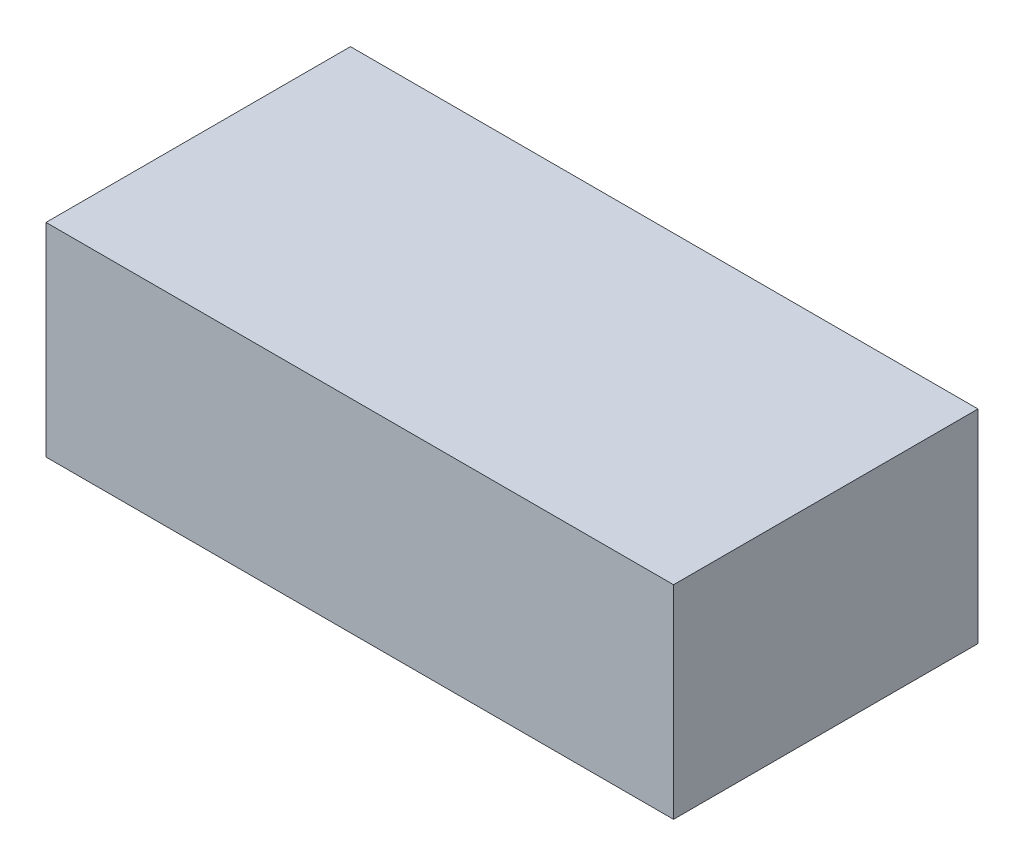
from build123d import *

# Parameters (mm, degrees)
SKETCH_1_W      = 49.1
SKETCH_1_H      = 23.82
EXTRUDE_1_DEPTH = 15.9


with BuildPart() as part:
    # 스케치1 → 보스-돌출1 (new body)
    with BuildSketch(Plane(origin=(0, 0, 0), x_dir=(1, 0, 0), z_dir=(0, 1, 0))):
        Rectangle(SKETCH_1_W, SKETCH_1_H)
    extrude(amount=EXTRUDE_1_DEPTH)


solid = part.part
